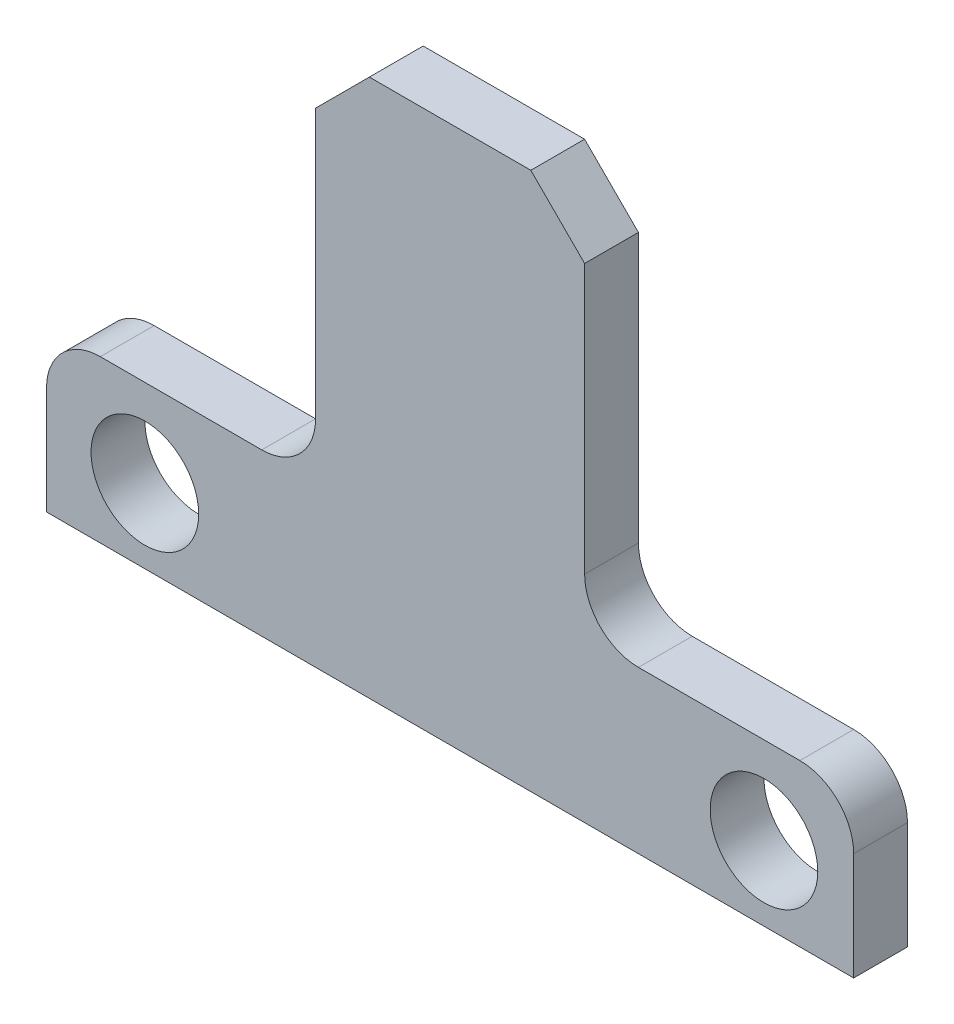
from build123d import *

# Parameters (mm, degrees)
SKETCH1_R           = 10
BOSS_EXTRUDE1_DEPTH = 10


with BuildPart() as part:
    # Sketch1 → Boss-Extrude1 (new body)
    with BuildSketch(Plane.XY):
        with BuildLine():
            Line((-33.27272534, 35.670760078), (-3.27272534, 35.670760078))
            Line((-3.27272534, 35.670760078), (6.72727466, 25.670760078))
            Line((6.72727466, 25.670760078), (6.72727466, -24.329239922))
            ThreePointArc((6.72727466, -24.329239922), (9.656206848, -31.400307734), (16.72727466, -34.329239922))
            Line((16.72727466, -34.329239922), (46.72727466, -34.329239922))
            ThreePointArc((46.72727466, -34.329239922), (53.798342472, -37.258172111), (56.72727466, -44.329239922))
            Line((56.72727466, -44.329239922), (56.72727466, -64.329239922))
            Line((56.72727466, -64.329239922), (-93.27272534, -64.329239922))
            Line((-93.27272534, -64.329239922), (-93.27272534, -44.329239922))
            ThreePointArc((-93.27272534, -44.329239922), (-90.343793152, -37.258172111), (-83.27272534, -34.329239922))
            Line((-83.27272534, -34.329239922), (-53.27272534, -34.329239922))
            ThreePointArc((-53.27272534, -34.329239922), (-46.201657528, -31.400307734), (-43.27272534, -24.329239922))
            Line((-43.27272534, -24.329239922), (-43.27272534, 25.670760078))
            Line((-43.27272534, 25.670760078), (-33.27272534, 35.670760078))
        make_face()
        with Locations((-74.996311147, -50.546321168)):
            Circle(SKETCH1_R, mode=Mode.SUBTRACT)
        with Locations((40.056509267, -50.546321168)):
            Circle(SKETCH1_R, mode=Mode.SUBTRACT)
    extrude(amount=BOSS_EXTRUDE1_DEPTH)


solid = part.part
